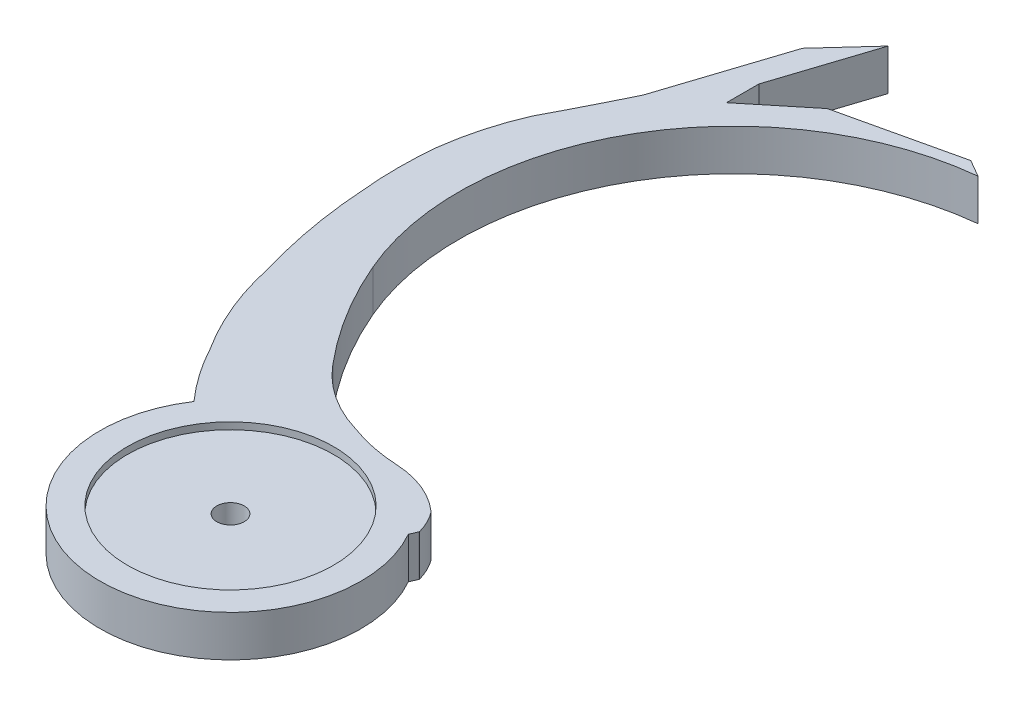
from build123d import *

# Parameters (mm, degrees)
SUNGU_KIRI_R        = 1
BOSS_EXTRUDE1_DEPTH = 3
SKETCH9_R           = 7.5
CUT_EXTRUDE5_DEPTH  = 0.5
SCALE1_SCALE        = 1.75


with BuildPart() as part:
    # sungu kiri → Boss-Extrude1 (new body)
    with BuildSketch(Plane(origin=(0, 0, 0), x_dir=(1, 0, 0), z_dir=(0, 1, 0))):
        with BuildLine():
            Line((-20.214241335, 18.58200887), (-17.903708636, 25.676772527))
            Line((-17.903708636, 25.676772527), (-20.879327355, 22.419581076))
            Line((-20.879327355, 22.419581076), (-23.726014444, 13.678492013))
            ThreePointArc((-23.726014444, 13.678492013), (-25.061399851, 10.98195956), (-26.444409257, 8.309539974))
            ThreePointArc((-26.444409257, 8.309539974), (-27.383764934, 5.63006722), (-27.936945566, 2.845115782))
            ThreePointArc((-27.936945566, 2.845115782), (-28.068014235, 0.18049064), (-27.936945566, -2.484134502))
            ThreePointArc((-27.936945566, -2.484134502), (-27.425713247, -6.715299694), (-26.444409257, -10.862727794))
            ThreePointArc((-26.444409257, -10.862727794), (-25.296755437, -14.61403578), (-23.488374839, -18.095297119))
            ThreePointArc((-23.488374839, -18.095297119), (-22.238356067, -20.131176806), (-20.758136978, -22.006357992))
            ThreePointArc((-20.758136978, -22.006357992), (-13.175246696, -36.755405871), (-4.582277955, -22.571064976))
            ThreePointArc((-4.582277955, -22.571064976), (-4.460378612, -22.299351604), (-4.344569641, -22.024987085))
            ThreePointArc((-4.344569641, -22.024987085), (-4.340995805, -22.01171692), (-4.3373846, -21.998456875))
            ThreePointArc((-4.3373846, -21.998456875), (-4.667057778, -21.129677391), (-5.155481579, -20.33916845))
            ThreePointArc((-5.155481579, -20.33916845), (-7.110923153, -19.117606911), (-9.361873626, -18.618421268))
            ThreePointArc((-9.361873626, -18.618421268), (-11.285784226, -18.376920372), (-13.150188878, -17.844238508))
            ThreePointArc((-13.150188878, -17.844238508), (-15.818147575, -16.60648921), (-18.010368345, -14.645827324))
            ThreePointArc((-18.010368345, -14.645827324), (-20.650416196, -11.005311906), (-22.72256926, -7.01414831))
            ThreePointArc((-22.72256926, -7.01414831), (-21.584958488, 10.98418111), (-6.423603233, 20.74980075))
            Line((-6.423603233, 20.74980075), (-7.667855794, 21.470443038))
            Line((-7.667855794, 21.470443038), (-16.17291449, 19.521519125))
            Line((-16.17291449, 19.521519125), (-20.214241335, 16.223172594))
            Line((-20.214241335, 16.223172594), (-20.214241335, 18.58200887))
        make_face()
        with Locations(Location((-12.843799059, -27.261189607, 0), (0, 0, 270))):
            Circle(SUNGU_KIRI_R, mode=Mode.SUBTRACT)
    extrude(amount=BOSS_EXTRUDE1_DEPTH)

    # Sketch9 → Cut-Extrude5 (cut)
    with BuildSketch(Plane(origin=(0, 3, 0), x_dir=(1, 0, 0), z_dir=(0, 1, 0))):
        with Locations(Location((-12.843799059, -27.261189607, 0), (0, 0, 270))):
            Circle(SKETCH9_R)
    extrude(amount=-CUT_EXTRUDE5_DEPTH, mode=Mode.SUBTRACT)


with BuildPart() as part_1:
    # Scale1: scaled about (-17.083309672, 1.422182795, 15.178250086)
    add(part.part.scale(SCALE1_SCALE).moved(Location((12.812482254, -1.066637096, -11.383687565))))


solid = part_1.part
